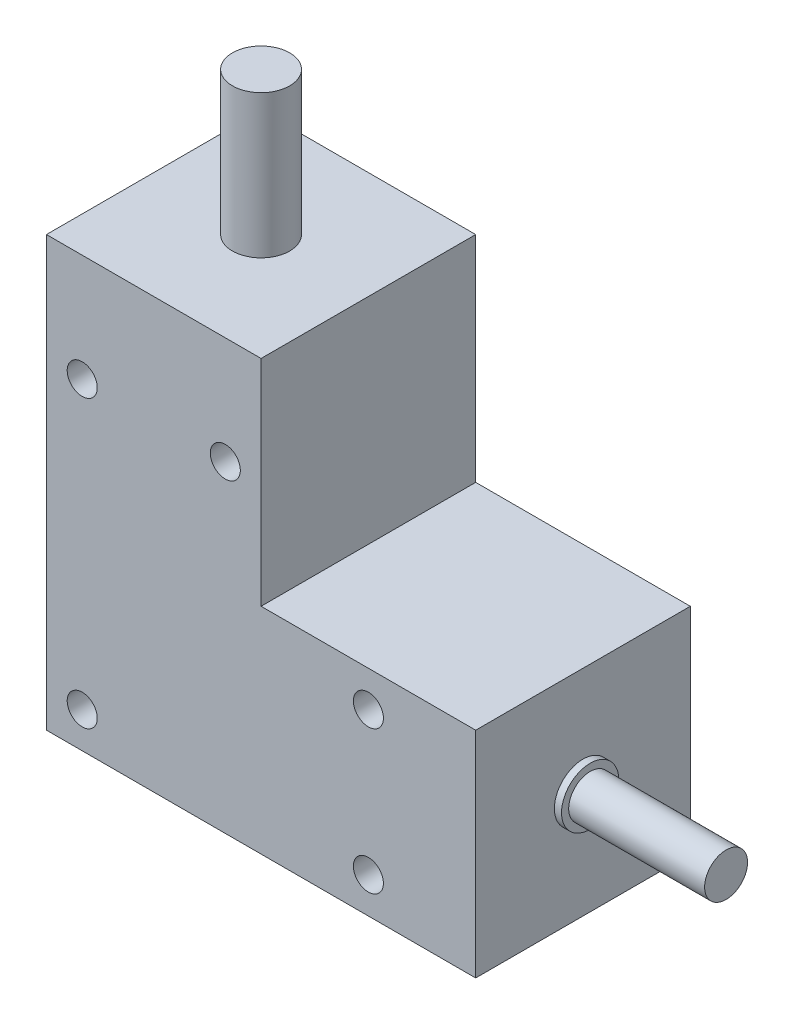
from build123d import *

# Parameters (mm, degrees)
BOSS_EXTRU_1_DEPTH             = 15
ESQUISSE3_R                    = 4
BOSS_EXTRU_2_DEPTH             = 20
ESQUISSE4_R                    = 4
BOSS_EXTRU_3_DEPTH             = 20
TROU_TARAUD_M5X0_85_AT_2_COUNT = 2
TROU_TARAUD_M5X0_85_AT_2_PITCH = 44.72135955
ENL_V_START                    = -19
ESQUISSE13_R                   = 4
ESQUISSE13_R_2                 = 3
ENL_V_MAT_EXTRU_1_DEPTH        = 19


with BuildPart() as part:
    # Esquisse1 → Boss.-Extru.1 (new, symmetric)
    with BuildSketch(Plane.XY):
        Polygon((0, 60), (30, 60), (30, 30), (60, 30), (60, 0), (0, 0), align=None)
    extrude(amount=BOSS_EXTRU_1_DEPTH, both=True)

    # Esquisse3 → Boss.-Extru.2 (add)
    with BuildSketch(Plane(origin=(0, 60, 0), x_dir=(-1, 0, 0), z_dir=(0, 1, 0))):
        with Locations(Location((-15, 0, 0), (0, 0, 270))):
            Circle(ESQUISSE3_R)
    extrude(amount=BOSS_EXTRU_2_DEPTH)

    # Esquisse4 → Boss.-Extru.3 (add)
    with BuildSketch(Plane(origin=(60, 0, 0), x_dir=(0, 0, -1), z_dir=(1, 0, 0))):
        with Locations(Location((0, 15, 0), (0, 0, 180))):
            Circle(ESQUISSE4_R)
    extrude(amount=BOSS_EXTRU_3_DEPTH)

    # Esquisse8 → Trou taraudé M5x0.82 (revolve, cut)
    with BuildSketch(Plane(origin=(45, 5, 15), x_dir=(0, -1, 0), z_dir=(1, 0, 0))):
        Polygon((0, 0), (0, 8.2618073), (2.1, 7), (2.1, 0), align=None)
    trou_taraud_m5x0_82 = revolve(axis=Axis((45, 5, 21.35), (0, 0, -1)), mode=Mode.SUBTRACT)

    # Esquisse9 → Trou taraudé M5x0.83 (revolve, cut)
    with BuildSketch(Plane(origin=(45, 25, 15), x_dir=(0, -1, 0), z_dir=(1, 0, 0))):
        Polygon((0, 0), (0, 8.2618073), (2.1, 7), (2.1, 0), align=None)
    trou_taraud_m5x0_83 = revolve(axis=Axis((45, 25, 21.35), (0, 0, -1)), mode=Mode.SUBTRACT)

    # Esquisse10 → Trou taraudé M5x0.84 (revolve, cut)
    with BuildSketch(Plane(origin=(5, 45, 15), x_dir=(0, -1, 0), z_dir=(1, 0, 0))):
        Polygon((0, 0), (0, 8.2618073), (2.1, 7), (2.1, 0), align=None)
    trou_taraud_m5x0_84 = revolve(axis=Axis((5, 45, 21.35), (0, 0, -1)), mode=Mode.SUBTRACT)

    # Esquisse12 → Trou taraudé M5x0.85 (revolve, cut)
    with BuildSketch(Plane(origin=(25, 45, 15), x_dir=(0, -1, 0), z_dir=(1, 0, 0))):
        Polygon((0, 0), (0, 8.2618073), (2.1, 7), (2.1, 0), align=None)
    trou_taraud_m5x0_85 = revolve(axis=Axis((25, 45, 21.35), (0, 0, -1)), mode=Mode.SUBTRACT)

    # Trou taraudé M5x0.85 at 2: Trou taraudé M5x0.85 ×2
    with Locations(*[Vector(-0.447213595499958, -0.8944271909999159, 0) * (i * TROU_TARAUD_M5X0_85_AT_2_PITCH) for i in range(1, TROU_TARAUD_M5X0_85_AT_2_COUNT)]):
        add(trou_taraud_m5x0_85, mode=Mode.SUBTRACT)

    # Symétrie1: Trou taraudé M5x0.82, Trou taraudé M5x0.83, Trou taraudé M5x0.84, Trou taraudé M5x0.85 across plane
    add(trou_taraud_m5x0_82.mirror(Plane.XY), mode=Mode.SUBTRACT)
    add(trou_taraud_m5x0_83.mirror(Plane.XY), mode=Mode.SUBTRACT)
    add(trou_taraud_m5x0_84.mirror(Plane.XY), mode=Mode.SUBTRACT)
    add(trou_taraud_m5x0_85.mirror(Plane.XY), mode=Mode.SUBTRACT)

    # Symétrie1 copy 1 sketch → Symétrie1 copy 1 (revolve, cut)
    with BuildSketch(Plane(origin=(5, 5, -15), x_dir=(0, -1, 0), z_dir=(1, 0, 0))):
        Polygon((0, 0), (0, -8.2618073), (2.1, -7), (2.1, 0), align=None)
    revolve(axis=Axis((5, 5, -21.35), (0, 0, -1)), mode=Mode.SUBTRACT)

    # Esquisse13 → Enlèv. mat.-Extru.1 (cut)
    with BuildSketch(Plane(origin=(80, 0, 0), x_dir=(0, 0, -1), z_dir=(1, 0, 0)).offset(ENL_V_START)):
        with Locations(Location((0, 15, 0), (0, 0, 180))):
            Circle(ESQUISSE13_R)
        with Locations((0, 15)):
            Circle(ESQUISSE13_R_2, mode=Mode.SUBTRACT)
    extrude(amount=ENL_V_MAT_EXTRU_1_DEPTH, mode=Mode.SUBTRACT)


solid = part.part
